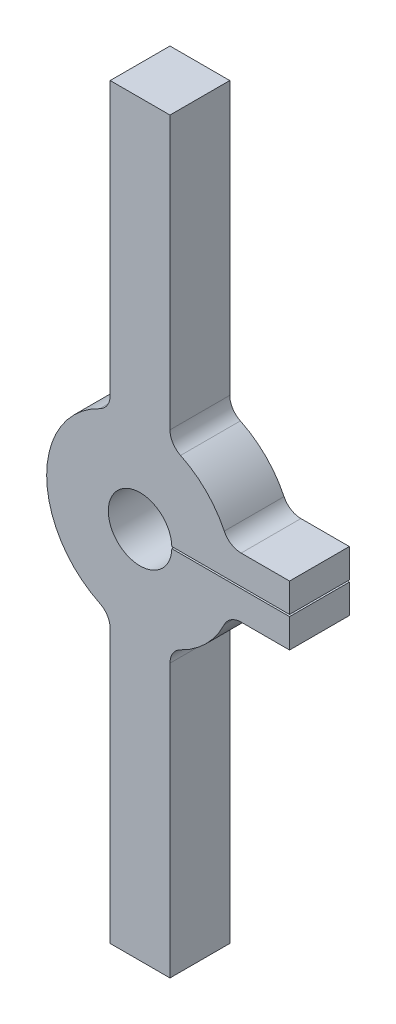
from build123d import *

# Parameters (mm, degrees)
SKETCH1_R               = 25
SKETCH1_R_2             = 8.5
BOSS_EXTRUDE1_DEPTH     = 8
SKETCH2_W               = 16
SKETCH2_H               = 76.314561435
BOSS_EXTRUDE2_DEPTH     = 8
SKETCH3_W               = 16
SKETCH3_H               = 76.314561435
BOSS_EXTRUDE3_DEPTH     = 8
SKETCH4_W               = 16.314561435
SKETCH4_H               = 16
BOSS_EXTRUDE4_DEPTH     = 8
CUT_EXTRUDE1_DEPTH      = 109
CUT_EXTRUDE1_DEPTH_BACK = 109
SKETCH5_W               = 48
SKETCH5_H               = 0.5
FILLET1_R               = 5


with BuildPart() as part:
    # Sketch1 → Boss-Extrude1 (new, symmetric)
    with BuildSketch(Plane.XY):
        Circle(SKETCH1_R)
        Circle(SKETCH1_R_2, mode=Mode.SUBTRACT)
    extrude(amount=BOSS_EXTRUDE1_DEPTH, both=True)

    # Sketch2 → Boss-Extrude2 (add, symmetric)
    with BuildSketch(Plane.XY):
        with Locations((0, 61.842719282)):
            Rectangle(SKETCH2_W, SKETCH2_H)
    extrude(amount=BOSS_EXTRUDE2_DEPTH, both=True)

    # Sketch3 → Boss-Extrude3 (add, symmetric)
    with BuildSketch(Plane.XY):
        with Locations((0, -61.842719282)):
            Rectangle(SKETCH3_W, SKETCH3_H)
    extrude(amount=BOSS_EXTRUDE3_DEPTH, both=True)

    # Sketch4 → Boss-Extrude4 (add, symmetric)
    with BuildSketch(Plane.XY):
        with Locations((31.842719282, 0)):
            Rectangle(SKETCH4_W, SKETCH4_H)
    extrude(amount=BOSS_EXTRUDE4_DEPTH, both=True)

    # Sketch5 → Cut-Extrude1 (cut, two sides: drawn at the far end of the back side and taken through both)
    with BuildSketch(Plane.XY.offset(-CUT_EXTRUDE1_DEPTH_BACK)):
        with Locations((26, 0)):
            Rectangle(SKETCH5_W, SKETCH5_H)
    extrude(amount=CUT_EXTRUDE1_DEPTH + CUT_EXTRUDE1_DEPTH_BACK, mode=Mode.SUBTRACT)

    # Fillet1
    fillet1_edges = [part.edges().sort_by_distance(p)[0] for p in [
        (8, 23.685438565, 0),
        (-8, 23.685438565, 0),
        (8, -23.685438565, 0),
        (-8, -23.685438565, 0),
        (23.685438565, -8, 0),
        (23.685438565, 8, 0),
    ]]
    fillet(fillet1_edges, radius=FILLET1_R)


solid = part.part
